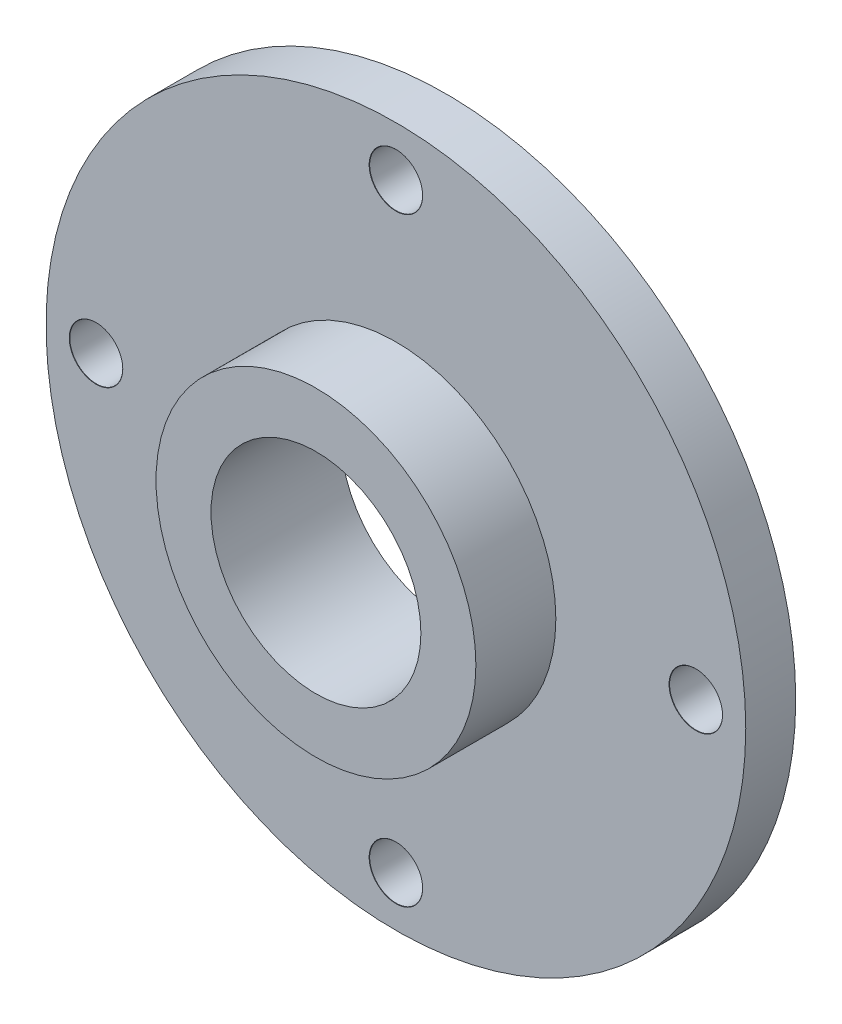
from build123d import *

# Parameters (mm, degrees)
SKETCH1_R                      = 35
SKETCH1_R_2                    = 10.5
BOSS_EXTRUDE1_DEPTH            = 5
M5_CLEARANCE_HOLE1_D           = 5.3
M5_CLEARANCE_HOLE1_CSINK_D     = 5.35
M5_CLEARANCE_HOLE1_CSINK_ANGLE = 90
CIRPATTERN1_COUNT              = 4
SKETCH5_R                      = 16
SKETCH5_R_2                    = 10.5
BOSS_EXTRUDE2_DEPTH            = 8


with BuildPart() as part:
    # Sketch1 → Boss-Extrude1 (new body)
    with BuildSketch(Plane.XY):
        Circle(SKETCH1_R)
        Circle(SKETCH1_R_2, mode=Mode.SUBTRACT)
    extrude(amount=BOSS_EXTRUDE1_DEPTH)

    # M5 Clearance Hole1 (through all)
    with Locations(Plane.XY.offset(5)):
        with Locations((0, 30)):
            m5_clearance_hole1 = CounterSinkHole(M5_CLEARANCE_HOLE1_D / 2, M5_CLEARANCE_HOLE1_CSINK_D / 2, counter_sink_angle=M5_CLEARANCE_HOLE1_CSINK_ANGLE)

    # CirPattern1: M5 Clearance Hole1 ×4 about axis
    cirpattern1_axis = Axis((0, 0, 0), (0, 0, 1))
    for i in range(1, CIRPATTERN1_COUNT):
        add(m5_clearance_hole1.rotate(cirpattern1_axis, i * 360 / CIRPATTERN1_COUNT), mode=Mode.SUBTRACT)

    # Sketch5 → Boss-Extrude2 (add)
    with BuildSketch(Plane.XY.offset(5)):
        Circle(SKETCH5_R)
        Circle(SKETCH5_R_2, mode=Mode.SUBTRACT)
    extrude(amount=BOSS_EXTRUDE2_DEPTH)


solid = part.part
